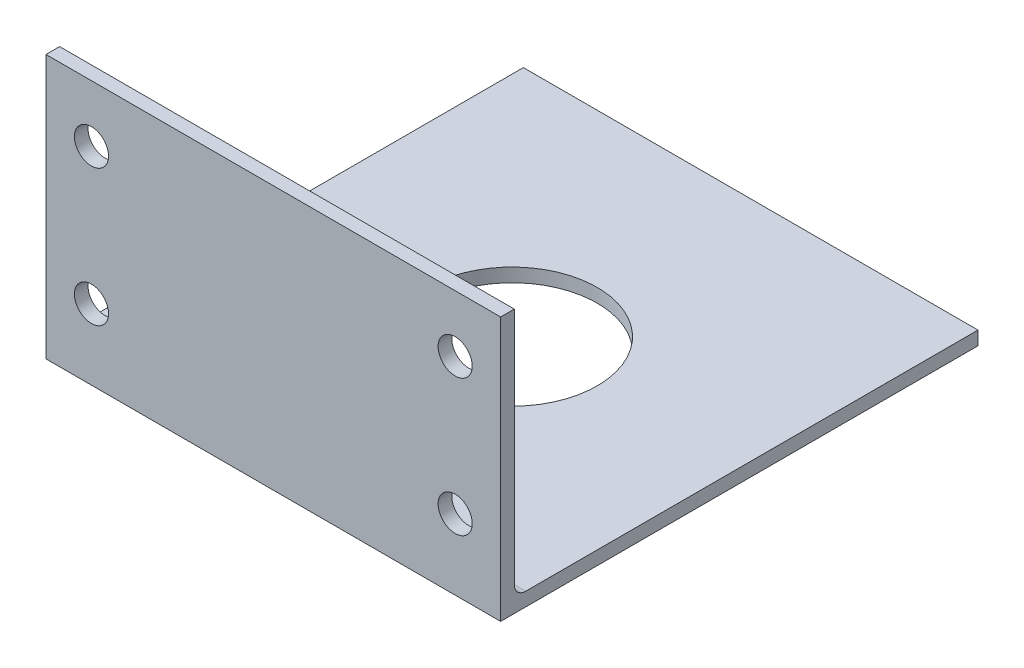
from build123d import *

# Parameters (mm, degrees)
SKETCH1_W           = 40
SKETCH1_H           = 42
BOSS_EXTRUDE1_DEPTH = 0.6
SKETCH3_R           = 7.5
CUT_EXTRUDE1_DEPTH  = 59.012412465
SKETCH4_W           = 40
SKETCH4_H           = 1.2
BOSS_EXTRUDE2_DEPTH = 22
SKETCH5_R           = 1.5
CUT_EXTRUDE2_DEPTH  = 62.444283705
FILLET1_R           = 1


with BuildPart() as part:
    # Sketch1 → Boss-Extrude1 (new, symmetric)
    with BuildSketch(Plane(origin=(0, 0, 0), x_dir=(1, 0, 0), z_dir=(0, 1, 0))):
        with Locations((20, 21)):
            Rectangle(SKETCH1_W, SKETCH1_H)
    extrude(amount=BOSS_EXTRUDE1_DEPTH, both=True)

    # Sketch3 → Cut-Extrude1 (cut, through all)
    with BuildSketch(Plane(origin=(0, 0.6, 0), x_dir=(1, 0, 0), z_dir=(0, 1, 0))):
        with Locations(Location((20, 21, 0), (0, 0, 270))):
            Circle(SKETCH3_R)
    extrude(amount=-CUT_EXTRUDE1_DEPTH, mode=Mode.SUBTRACT)

    # Sketch4 → Boss-Extrude2 (add)
    with BuildSketch(Plane(origin=(0, 0.6, 0), x_dir=(1, 0, 0), z_dir=(0, 1, 0))):
        with Locations((20, 0.6)):
            Rectangle(SKETCH4_W, SKETCH4_H)
    extrude(amount=BOSS_EXTRUDE2_DEPTH)

    # Sketch5 → Cut-Extrude2 (cut, through all)
    with BuildSketch(Plane(origin=(0, 0, -1.2), x_dir=(-1, 0, 0), z_dir=(0, 0, -1))):
        with Locations((-36, 17.6)):
            Circle(SKETCH5_R)
        with Locations((-36, 5.6)):
            Circle(SKETCH5_R)
        with Locations((-4, 17.6)):
            Circle(SKETCH5_R)
        with Locations((-4, 5.6)):
            Circle(SKETCH5_R)
    extrude(amount=-CUT_EXTRUDE2_DEPTH, mode=Mode.SUBTRACT)

    # Fillet1
    fillet1_edges = [part.edges().sort_by_distance(p)[0] for p in [
        (20, 0.6, -1.2),
    ]]
    fillet(fillet1_edges, radius=FILLET1_R)


solid = part.part
